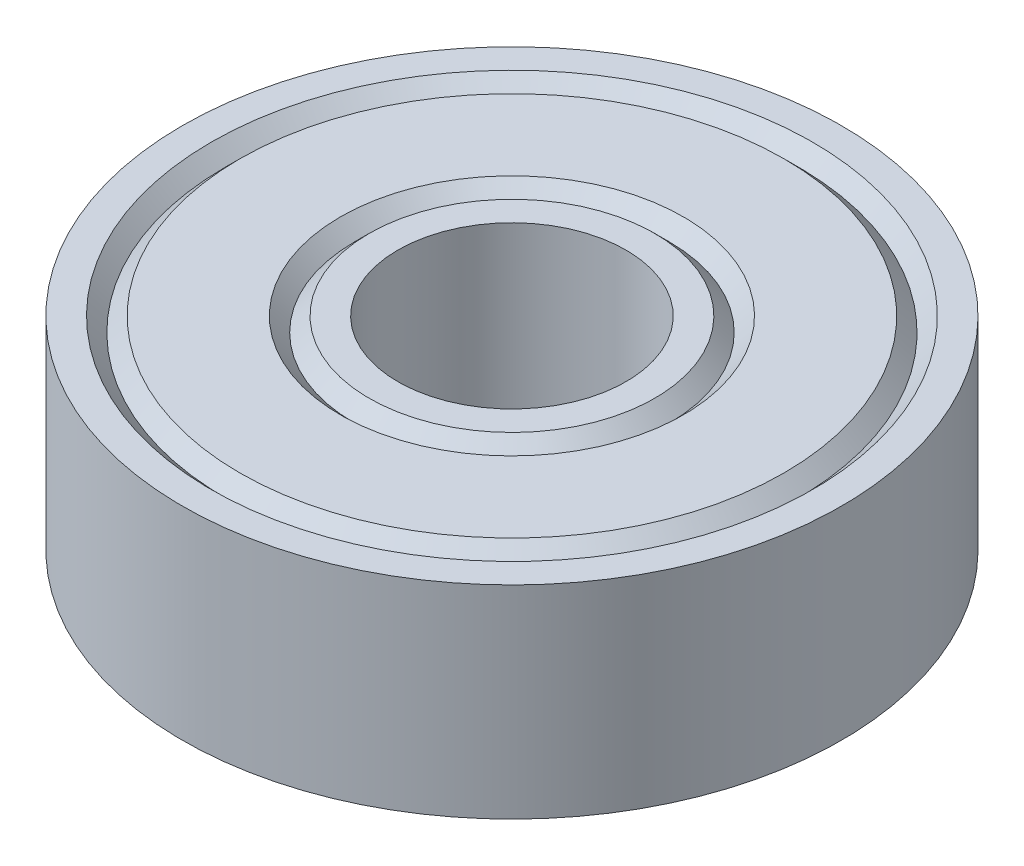
from build123d import *


with BuildPart() as part:
    # Sketch1 → Revolve1 (revolve)
    with BuildSketch(Plane.XY):
        Polygon((-4.5, 4), (-5.633333333, 4), (-6.2, 3.433333333), (-6.766666667, 4), (-10.733333333, 4), (-11.3, 3.433333333), (-11.866666667, 4), (-13, 4), (-13, -4), (-11.866666667, -4), (-11.3, -3.433333333), (-10.733333333, -4), (-6.766666667, -4), (-6.2, -3.433333333), (-5.633333333, -4), (-4.5, -4), align=None)
    revolve(axis=Axis((0, 4, 0), (0, -1, 0)))


solid = part.part
